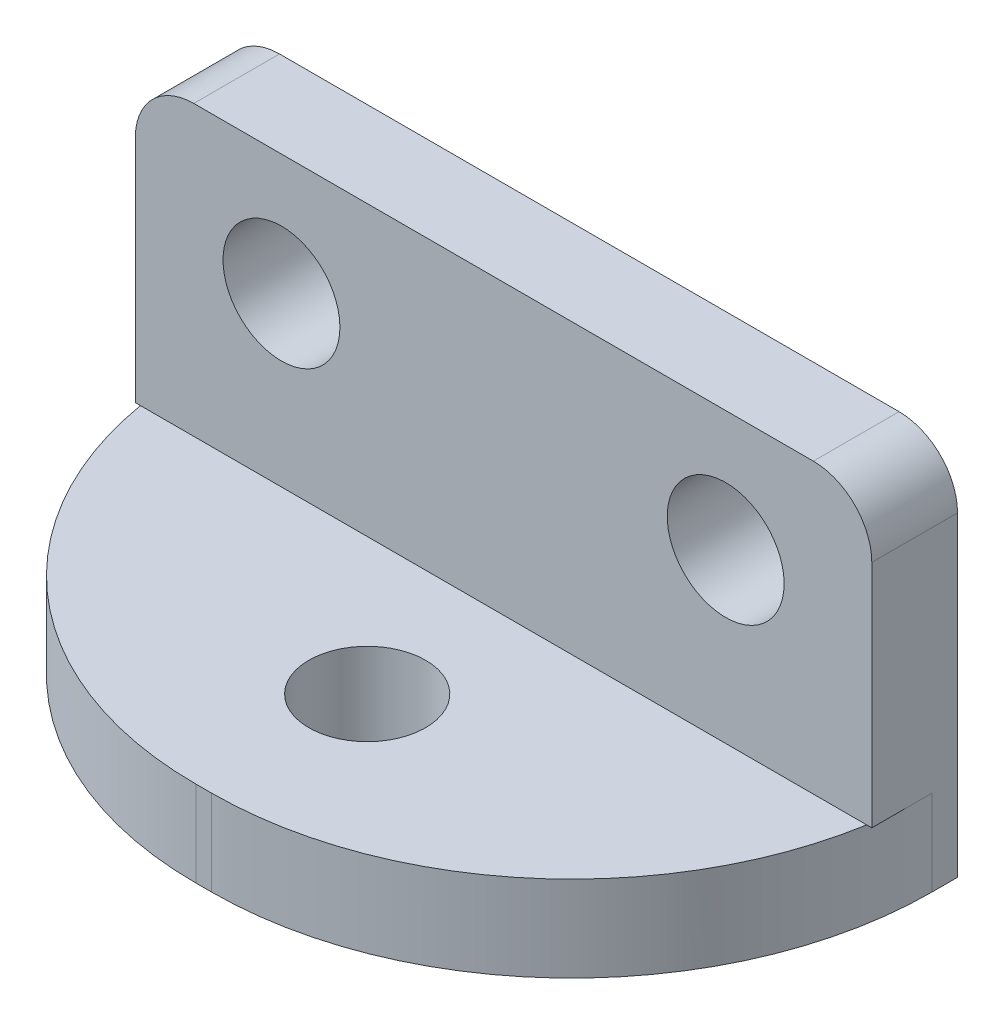
from build123d import *

# Parameters (mm, degrees)
SKETCH1_R           = 1.5
BOSS_EXTRUDE1_DEPTH = 2.2
SKETCH2_W           = 18.9
SKETCH2_H           = 2.2
BOSS_EXTRUDE2_DEPTH = 7.7
SKETCH3_R           = 1.5
CUT_EXTRUDE1_DEPTH  = 2.2


with BuildPart() as part:
    # Sketch1 → Boss-Extrude1 (new body)
    with BuildSketch(Plane.XY):
        with BuildLine():
            Line((0, 0), (18.9, 0))
            Line((18.9, 0), (18.9, 8.1))
            ThreePointArc((18.9, 8.1), (18.460660172, 9.160660172), (17.4, 9.6))
            Line((17.4, 9.6), (1.5, 9.6))
            ThreePointArc((1.5, 9.6), (0.439339828, 9.160660172), (0, 8.1))
            Line((0, 8.1), (0, 0))
        make_face()
        with Locations((3.75, 6.5)):
            Circle(SKETCH1_R, mode=Mode.SUBTRACT)
        with Locations((15.15, 6.5)):
            Circle(SKETCH1_R, mode=Mode.SUBTRACT)
    extrude(amount=BOSS_EXTRUDE1_DEPTH)

    # Sketch2 → Boss-Extrude2 (add)
    with BuildSketch(Plane.XY.offset(2.2)):
        with Locations((9.45, 1.1)):
            Rectangle(SKETCH2_W, SKETCH2_H)
    extrude(amount=BOSS_EXTRUDE2_DEPTH)

    # Sketch3 → Cut-Extrude1 (cut)
    with BuildSketch(Plane.XZ):
        with BuildLine():
            Line((0, 9.9), (0, 0.65))
            ThreePointArc((0, 0.65), (2.709262274, 7.190737726), (9.25, 9.9))
            Line((9.25, 9.9), (0, 9.9))
        make_face()
        with BuildLine():
            Line((18.9, 9.9), (9.65, 9.9))
            ThreePointArc((9.65, 9.9), (16.190737726, 7.190737726), (18.9, 0.65))
            Line((18.9, 0.65), (18.9, 9.9))
        make_face()
        with Locations(Location((9.45, 5.7, 0), (0, 0, 270))):
            Circle(SKETCH3_R)
    extrude(amount=-CUT_EXTRUDE1_DEPTH, mode=Mode.SUBTRACT)


solid = part.part
